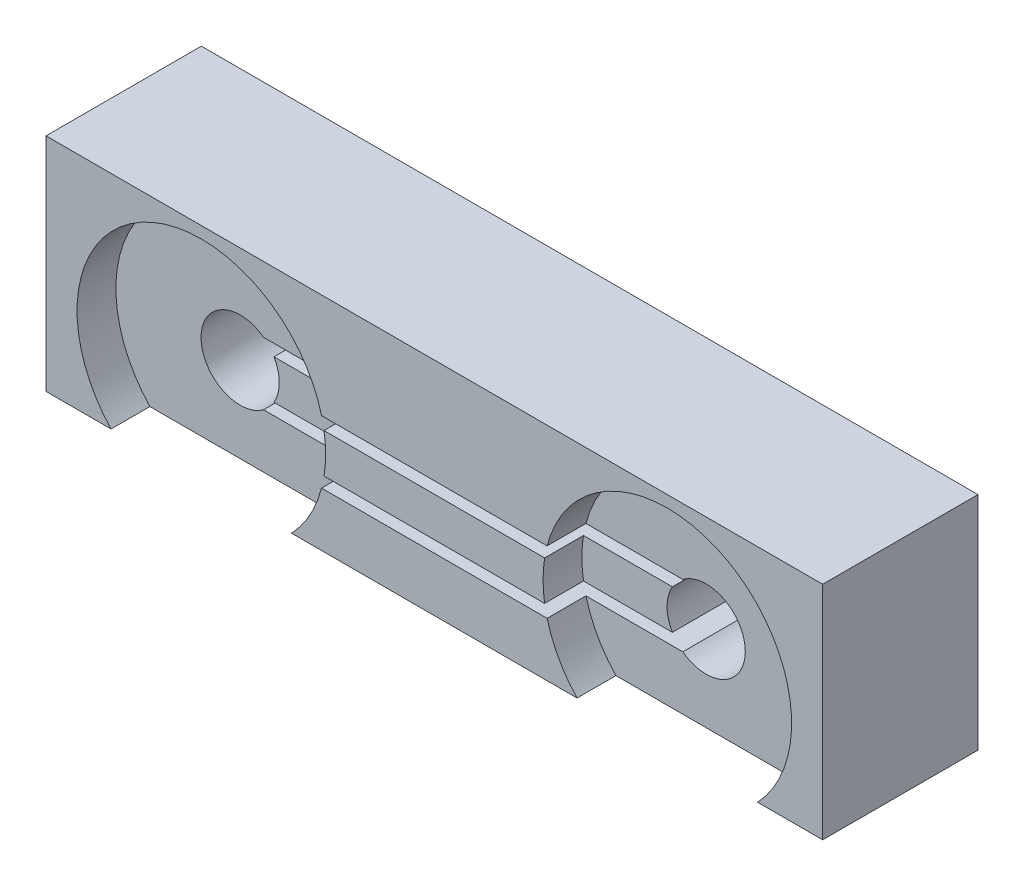
from build123d import *

# Parameters (mm, degrees)
SKETCH1_W                     = 200
SKETCH1_H                     = 70
BOSS_EXTRUDE1_DEPTH           = 40
SHAFTFITS_REACH               = 115.248
SKETCH2_R                     = 2.75
SKETCH3_R                     = 8.075
PULLEY_DEPTH                  = 30
SKETCH4_R                     = 30
GEARS_FITS_DEPTH              = 10
GEAR_LETOUT_REACH             = 115.248
SKETCH5_W                     = 200
SKETCH5_H                     = 13
CLOSED_LOOP_TIMING_BELT_REACH = 115.248
SKETCH8_W                     = 120
SKETCH8_H                     = 3
SKETCH6_R                     = 32
GEAR_MARGIN_DEPTH             = 10
SKETCH7_R                     = 10.075
PULLEY_MARGIN_DEPTH           = 20


with BuildPart() as part:
    # Sketch1 → Boss-Extrude1 (new body)
    with BuildSketch(Plane.XY):
        Rectangle(SKETCH1_W, SKETCH1_H)
    extrude(amount=BOSS_EXTRUDE1_DEPTH)

    # Sketch2 → ShaftFits (cut, up to next)
    with BuildSketch(Plane.XY.offset(40), mode=Mode.PRIVATE) as shaftfits_sk1:
        with Locations((60, 0)):
            Circle(SKETCH2_R)
    shaftfits_tool1 = extrude(shaftfits_sk1.sketch, amount=-SHAFTFITS_REACH, mode=Mode.PRIVATE) & part.part
    # Sketch2 → ShaftFits (cut, up to next)
    with BuildSketch(Plane.XY.offset(40), mode=Mode.PRIVATE) as shaftfits_sk2:
        with Locations(Location((-60, 0, 0), (0, 0, 180))):
            Circle(SKETCH2_R)
    shaftfits_tool2 = extrude(shaftfits_sk2.sketch, amount=-SHAFTFITS_REACH, mode=Mode.PRIVATE) & part.part
    add(shaftfits_tool1.solids().sort_by_distance((60, 0, 40))[0], mode=Mode.SUBTRACT)
    add(shaftfits_tool2.solids().sort_by_distance((-60, 0, 40))[0], mode=Mode.SUBTRACT)

    # Sketch3 → Pulley (cut)
    with BuildSketch(Plane.XY.offset(40)):
        with Locations((60, 0)):
            Circle(SKETCH3_R)
        with Locations(Location((-60, 0, 0), (0, 0, 180))):
            Circle(SKETCH3_R)
    extrude(amount=-PULLEY_DEPTH, mode=Mode.SUBTRACT)

    # Sketch4 → Gears fits (cut)
    with BuildSketch(Plane.XY.offset(40)):
        with Locations((60, 0)):
            Circle(SKETCH4_R)
        with Locations(Location((-60, 0, 0), (0, 0, 180))):
            Circle(SKETCH4_R)
    extrude(amount=-GEARS_FITS_DEPTH, mode=Mode.SUBTRACT)

    # Sketch5 → Gear letout (cut, up to next)
    with BuildSketch(Plane.XY.offset(40), mode=Mode.PRIVATE) as gear_letout_sk1:
        with Locations((0, -28.5)):
            Rectangle(SKETCH5_W, SKETCH5_H)
    gear_letout_tool1 = extrude(gear_letout_sk1.sketch, amount=-GEAR_LETOUT_REACH, mode=Mode.PRIVATE) & part.part
    add(gear_letout_tool1.solids().sort_by_distance((0, -28.5, 40))[0], mode=Mode.SUBTRACT)

    # Closed-loop timing belt: up to this face of the body (flat: up to its plane)
    closed_loop_timing_belt_end = Plane(part.part.faces().sort_by_distance((-52.15339549, 0, 10))[0])
    # Sketch8 → Closed-loop timing belt (cut, up to the picked face)
    with BuildSketch(Plane.XY.offset(40), mode=Mode.PRIVATE) as closed_loop_timing_belt_sk1:
        with Locations((0, 6.575)):
            Rectangle(SKETCH8_W, SKETCH8_H)
    closed_loop_timing_belt_tool1 = split(extrude(closed_loop_timing_belt_sk1.sketch, amount=-CLOSED_LOOP_TIMING_BELT_REACH, mode=Mode.PRIVATE), bisect_by=closed_loop_timing_belt_end, keep=Keep.BOTH, mode=Mode.PRIVATE)
    # Sketch8 → Closed-loop timing belt (cut, up to the picked face)
    with BuildSketch(Plane.XY.offset(40), mode=Mode.PRIVATE) as closed_loop_timing_belt_sk2:
        with Locations((0, -6.575)):
            Rectangle(SKETCH8_W, SKETCH8_H)
    closed_loop_timing_belt_tool2 = split(extrude(closed_loop_timing_belt_sk2.sketch, amount=-CLOSED_LOOP_TIMING_BELT_REACH, mode=Mode.PRIVATE), bisect_by=closed_loop_timing_belt_end, keep=Keep.BOTH, mode=Mode.PRIVATE)
    add(closed_loop_timing_belt_tool1.solids().sort_by(Axis((0, 6.575, 40), (0, 0, -1)))[0], mode=Mode.SUBTRACT)
    add(closed_loop_timing_belt_tool2.solids().sort_by(Axis((0, -6.575, 40), (0, 0, -1)))[0], mode=Mode.SUBTRACT)

    # Sketch6 → Gear margin (cut)
    with BuildSketch(Plane.XY.offset(40)):
        with Locations((60, 0)):
            Circle(SKETCH6_R)
        with Locations((-60, 0)):
            Circle(SKETCH6_R)
    extrude(amount=-GEAR_MARGIN_DEPTH, mode=Mode.SUBTRACT)

    # Sketch7 → Pulley margin (cut)
    with BuildSketch(Plane.XY.offset(30)):
        with Locations((60, 0)):
            Circle(SKETCH7_R)
        with Locations((-60, 0)):
            Circle(SKETCH7_R)
    extrude(amount=-PULLEY_MARGIN_DEPTH, mode=Mode.SUBTRACT)


solid = part.part
